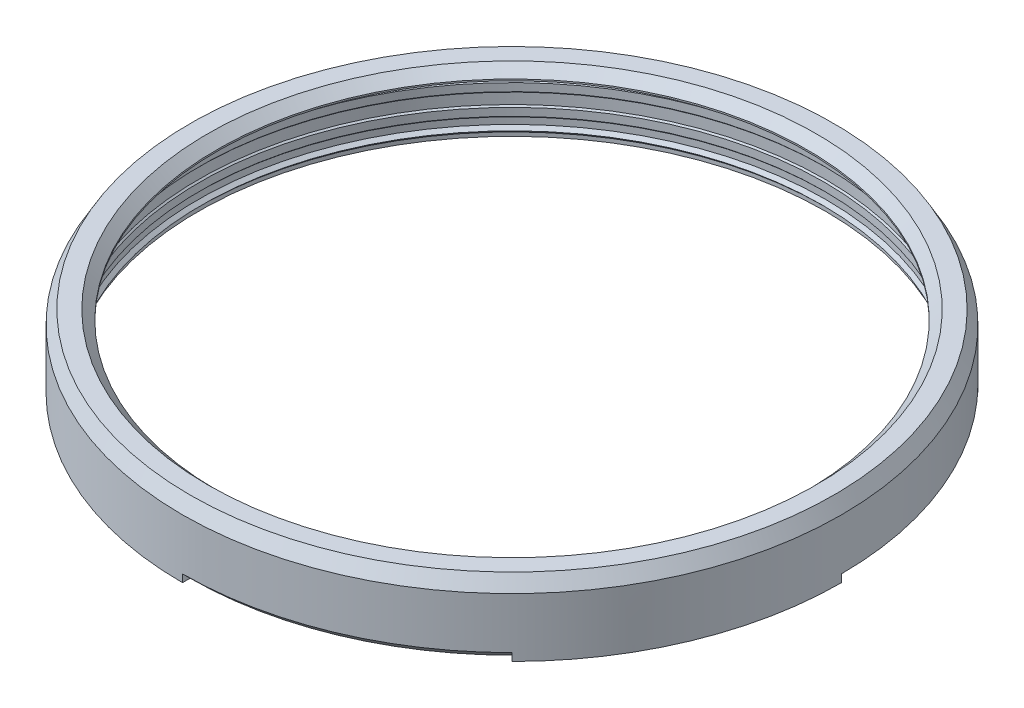
from build123d import *

# Parameters (mm, degrees)
SKETCH_1_R               = 43
EXTRUDE_1_DEPTH          = 2
SKETCH_3_R               = 38.5
CUT_EXTRUDE_1_DEPTH      = 62.627915753
CUT_EXTRUDE_START        = -0.6
SKETCH_5_R               = 43
CUT_EXTRUDE_3_DEPTH      = 0.6
CHAMFER_1_SIZE           = 1.2
CHAMFER_2_SIZE           = 1.732
CHAMFER_2_SIZE2          = 0.999970666
CUT_REVOLVE_1_ANGLE      = 45
PATTERN_CIRCULAR_1_COUNT = 4
SKETCH_7_R               = 39.78
SKETCH_7_R_2             = 39.32
EXTRUDE_2_DEPTH          = 0.5


with BuildPart() as part:
    # 草图1 → 凸台-拉伸1 (new body)
    with BuildSketch(Plane(origin=(0, 0, 0), x_dir=(1, 0, 0), z_dir=(0, 1, 0))):
        with Locations(Location((0, 0, 0), (0, 0, 270))):
            Circle(SKETCH_1_R)
    extrude(amount=EXTRUDE_1_DEPTH)

    # 草图2 → 旋转1 (revolve)
    with BuildSketch(Plane(origin=(0, 0, 0), x_dir=(0.47715876025962745, 0, 0.8788171126619551), z_dir=(-0.8788171126619551, 0, 0.47715876025962745)), mode=Mode.PRIVATE) as revolve_1_sk:
        with BuildLine():
            Line((40.93, -8), (40.93, -7.5))
            Line((40.93, -7.5), (40.505, -7.075))
            Line((40.505, -7.075), (40.93, -6.65))
            Line((40.93, -6.65), (40.93, -5.8))
            Line((40.93, -5.8), (40.74, -5.61))
            Line((40.74, -5.61), (40.74, -4.59))
            Line((40.74, -4.59), (40.93, -4.4))
            Line((40.93, -4.4), (40.93, -3))
            Line((40.93, -3), (40.74, -2.81))
            Line((40.74, -2.81), (40.74, -1.79))
            Line((40.74, -1.79), (40.93, -1.6))
            Line((40.93, -1.6), (40.93, -1.4))
            ThreePointArc((40.93, -1.4), (40.519949494, -0.410050506), (39.53, 0))
            Line((39.53, 0), (43, 0))
            Line((43, 0), (43, -8))
            Line((43, -8), (40.93, -8))
        make_face()
    revolve(revolve_1_sk.sketch.rotate(Axis((0, 0, 0), (0, 1, 0)), 151.5), axis=Axis((0, 0, 0), (0, 1, 0)))

    # 草图3 → 切除-拉伸1 (cut, through all)
    with BuildSketch(Plane(origin=(0, 2, 0), x_dir=(1, 0, 0), z_dir=(0, 1, 0))):
        with Locations(Location((0, 0, 0), (0, 0, 270))):
            Circle(SKETCH_3_R)
    extrude(amount=-CUT_EXTRUDE_1_DEPTH, mode=Mode.SUBTRACT)

    # 草图5 → 切除-拉伸3 (cut)
    with BuildSketch(Plane(origin=(0, 2, 0), x_dir=(1, 0, 0), z_dir=(0, 1, 0)).offset(CUT_EXTRUDE_START)):
        with Locations(Location((0, 0, 0), (0, 0, 90))):
            Circle(SKETCH_5_R)
    extrude(amount=CUT_EXTRUDE_3_DEPTH, mode=Mode.SUBTRACT)

    # 倒角1
    chamfer_1_edges = [part.edges().sort_by_distance(p)[0] for p in [
        (0, 1.4, -38.5),
    ]]
    chamfer(chamfer_1_edges, length=CHAMFER_1_SIZE)

    # 倒角2
    chamfer_2_edges = [part.edges().sort_by_distance(p)[0] for p in [
        (0, 1.4, -43),
    ]]
    chamfer_2_side = [part.faces().sort_by_distance(p)[0] for p in [
        (43, -3.3, 0),
    ]]
    chamfer(chamfer_2_edges, length=CHAMFER_2_SIZE, length2=CHAMFER_2_SIZE2, reference=chamfer_2_side[0])

    # 草图6 → 切除-旋转1 (revolve, cut)
    with BuildSketch(Plane.XY):
        Polygon((43, -8), (43, -7), (42, -8), align=None)
    cut_revolve_1 = revolve(axis=Axis((0, 0, 0), (0, 1, 0)), revolution_arc=CUT_REVOLVE_1_ANGLE, mode=Mode.SUBTRACT)

    # 阵列(圆周)1: 切除-旋转1 ×4 about axis
    pattern_circular_1_axis = Axis((0, 0, 0), (0, 1, 0))
    for i in range(1, PATTERN_CIRCULAR_1_COUNT):
        add(cut_revolve_1.rotate(pattern_circular_1_axis, i * 360 / PATTERN_CIRCULAR_1_COUNT), mode=Mode.SUBTRACT)

    # 草图7 → 凸台-拉伸2 (add)
    with BuildSketch(Plane.XZ):
        with Locations(Location((0, 0, 0), (0, 0, 270))):
            Circle(SKETCH_7_R)
        with Locations(Location((0, 0, 0), (0, 0, 270))):
            Circle(SKETCH_7_R_2, mode=Mode.SUBTRACT)
    extrude(amount=EXTRUDE_2_DEPTH)


solid = part.part
